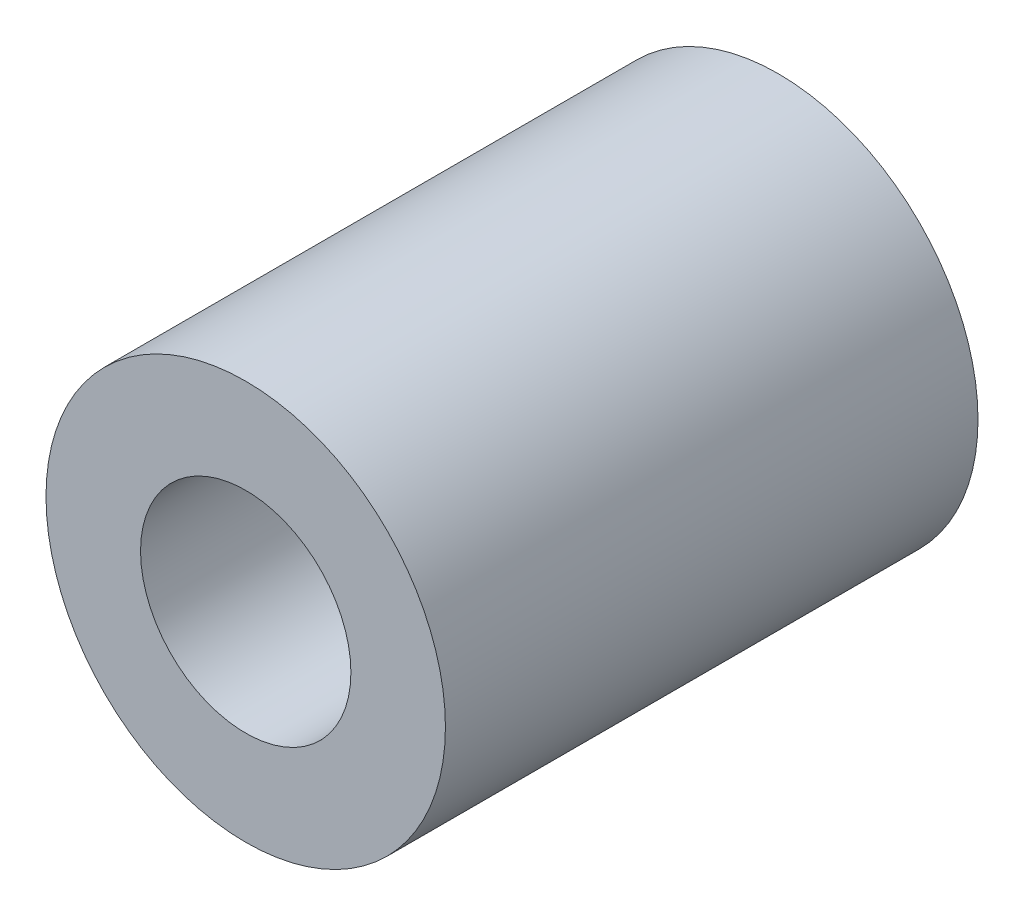
from build123d import *

# Parameters (mm, degrees)
SKETCH1_R      = 19.05
SKETCH1_R_2    = 10.033
EXTRUDE1_DEPTH = 50.8


with BuildPart() as part:
    # Sketch1 → Extrude1 (new body)
    with BuildSketch(Plane.XY):
        Circle(SKETCH1_R)
        Circle(SKETCH1_R_2, mode=Mode.SUBTRACT)
    extrude(amount=EXTRUDE1_DEPTH)


solid = part.part
